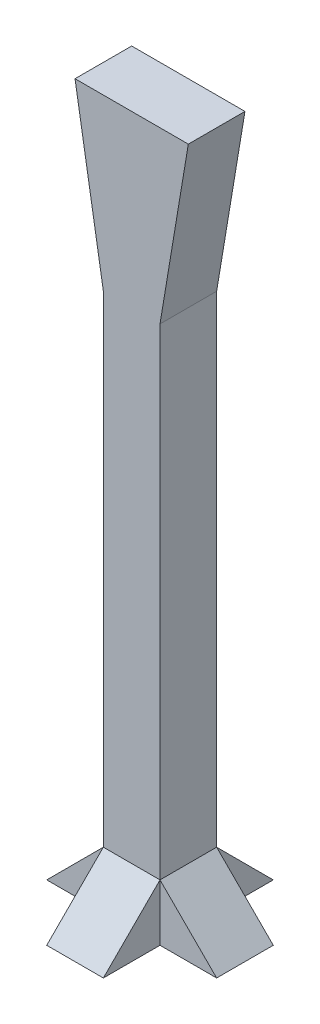
from build123d import *

# Parameters (mm, degrees)
SKETCH1_W           = 20
SKETCH1_H           = 250
BOSS_EXTRUDE1_DEPTH = 20
BOSS_EXTRUDE2_DEPTH = 20
BOSS_EXTRUDE3_DEPTH = 20
BOSS_EXTRUDE4_DEPTH = 20


with BuildPart() as part:
    # Sketch1 → Boss-Extrude1 (new body)
    with BuildSketch(Plane.XY):
        Rectangle(SKETCH1_W, SKETCH1_H)
    extrude(amount=BOSS_EXTRUDE1_DEPTH)

    # Sketch2 → Boss-Extrude2 (add)
    with BuildSketch(Plane.XY.offset(20)):
        Polygon((10, -125), (10, -105), (30, -125), align=None)
    boss_extrude2 = extrude(amount=-BOSS_EXTRUDE2_DEPTH)

    # Mirror2: Boss-Extrude2 across plane
    add(boss_extrude2.mirror(Plane(origin=(0, 0, 0), x_dir=(0, 0, 1), z_dir=(1, 0, 0))))

    # Sketch3 → Boss-Extrude3 (add)
    with BuildSketch(Plane(origin=(10, 0, 0), x_dir=(0, 0, -1), z_dir=(1, 0, 0))):
        Polygon((-20, -105), (-20, -125), (-40, -125), align=None)
    boss_extrude3 = extrude(amount=-BOSS_EXTRUDE3_DEPTH)

    # Mirror3: Boss-Extrude3 across plane
    add(boss_extrude3.mirror(Plane(origin=(0, 0, 10), x_dir=(1, 0, 0), z_dir=(0, 0, -1))))

    # Sketch4 → Boss-Extrude4 (add)
    with BuildSketch(Plane.XY.offset(20)):
        Polygon((-10, 125), (-20, 125), (-10, 65), align=None)
    boss_extrude4 = extrude(amount=-BOSS_EXTRUDE4_DEPTH)

    # Mirror4: Boss-Extrude4 across plane
    add(boss_extrude4.mirror(Plane(origin=(0, 0, 0), x_dir=(0, 0, 1), z_dir=(1, 0, 0))))


solid = part.part
